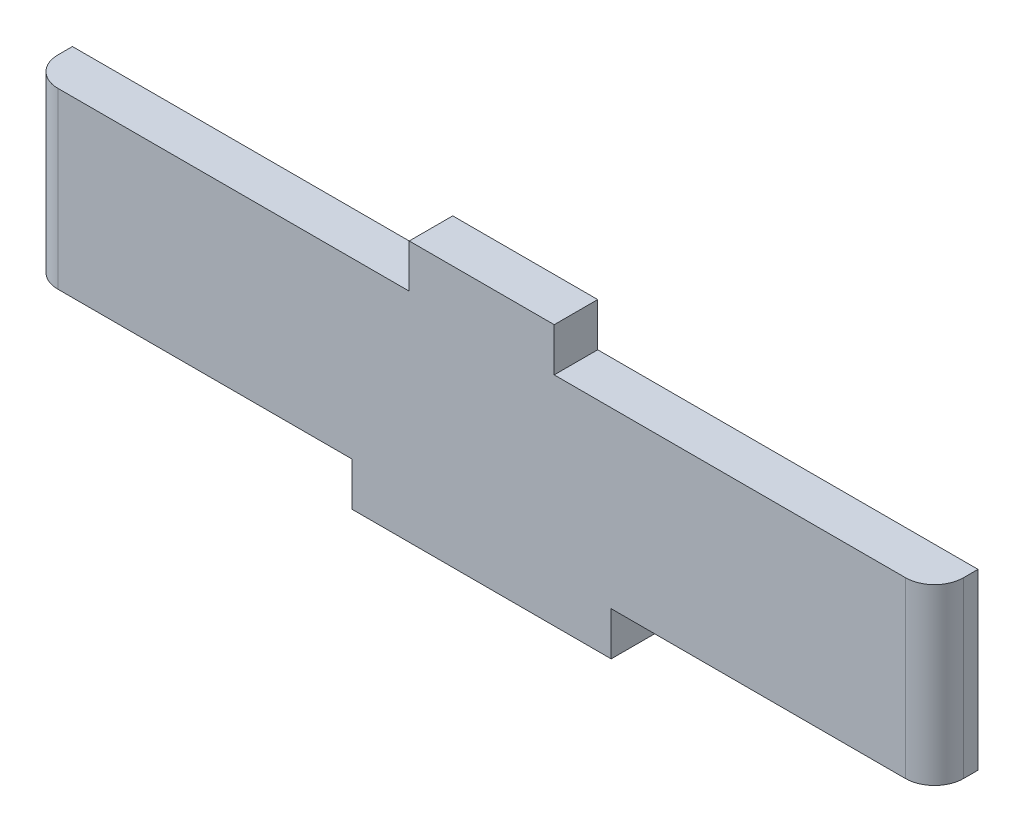
from build123d import *

# Parameters (mm, degrees)
SKETCH1_W           = 62.46
SKETCH1_H           = 18
BOSS_EXTRUDE1_DEPTH = 3
SKETCH2_W           = 22.3
SKETCH2_H           = 3
SKETCH2_W_2         = 22.29
SKETCH2_W_3         = 26.23
CUT_EXTRUDE1_DEPTH  = 3
FILLET1_R           = 2
FILLET2_R           = 2


with BuildPart() as part:
    # Sketch1 → Boss-Extrude1 (new body)
    with BuildSketch(Plane.XY):
        Rectangle(SKETCH1_W, SKETCH1_H)
    extrude(amount=BOSS_EXTRUDE1_DEPTH)

    # Sketch2 → Cut-Extrude1 (cut)
    with BuildSketch(Plane.XY.offset(3)):
        with Locations((20.08, -7.5)):
            Rectangle(SKETCH2_W, SKETCH2_H)
        with Locations((-20.085, -7.5)):
            Rectangle(SKETCH2_W_2, SKETCH2_H)
        with Locations((18.115, 7.5)):
            Rectangle(SKETCH2_W_3, SKETCH2_H)
        with Locations((-18.115, 7.5)):
            Rectangle(SKETCH2_W_3, SKETCH2_H)
    extrude(amount=-CUT_EXTRUDE1_DEPTH, mode=Mode.SUBTRACT)

    # Fillet1
    fillet1_edges = [part.edges().sort_by_distance(p)[0] for p in [
        (31.23, 0, 3),
    ]]
    fillet(fillet1_edges, radius=FILLET1_R)

    # Fillet2
    fillet2_edges = [part.edges().sort_by_distance(p)[0] for p in [
        (-31.23, 0, 3),
    ]]
    fillet(fillet2_edges, radius=FILLET2_R)


solid = part.part
